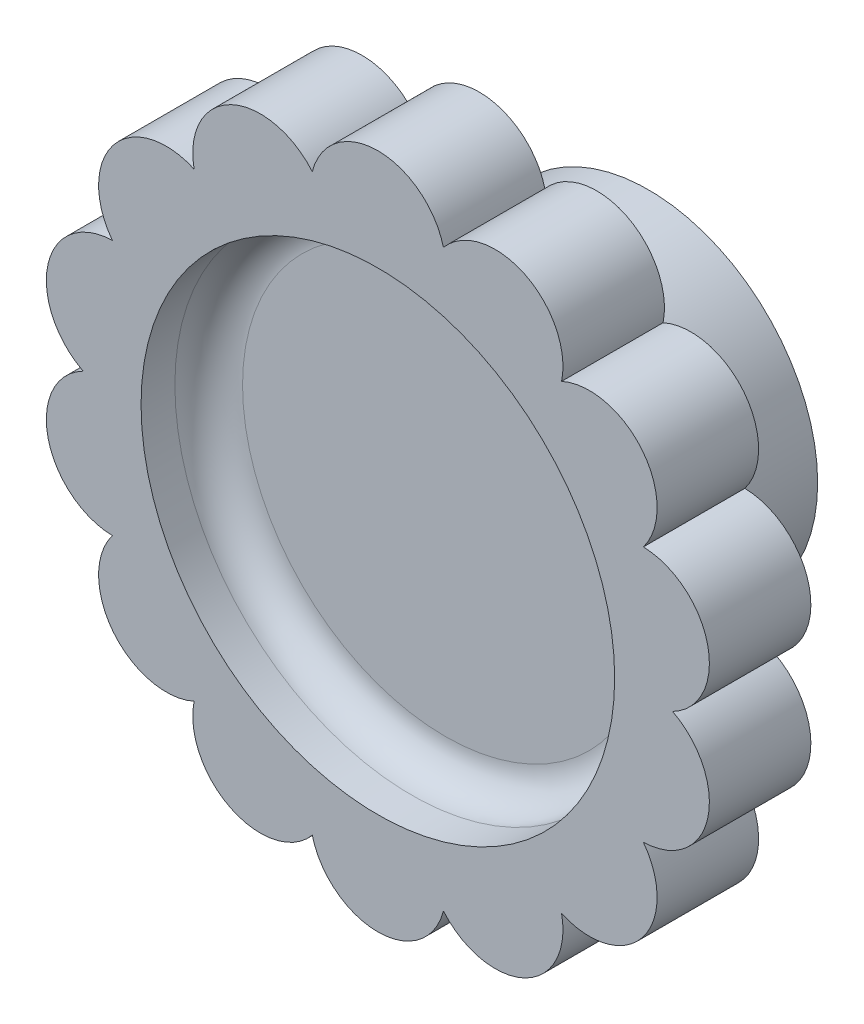
from build123d import *

# Parameters (mm, degrees)
SKETCH_1_R          = 10
SKETCH_1_R_2        = 8
EXTRUDE_1_DEPTH     = 10
EXTRUDE_2_DEPTH     = 6
SKETCH_3_R          = 14
CUT_EXTRUDE_1_DEPTH = 4
FILLET_1_R          = 2


with BuildPart() as part:
    # Эскиз1 → Бобышка-Вытянуть1 (new body)
    with BuildSketch(Plane.XY):
        Circle(SKETCH_1_R)
        Circle(SKETCH_1_R_2, mode=Mode.SUBTRACT)
    extrude(amount=EXTRUDE_1_DEPTH)

    # Эскиз2 → Бобышка-Вытянуть2 (add)
    with BuildSketch(Plane.XY.offset(10)):
        with BuildLine():
            ThreePointArc((3.876767447, 16.985227976), (0, 20), (-3.876767447, 16.985227976))
            ThreePointArc((-3.876767447, 16.985227976), (-8.677674782, 18.019377358), (-10.862461002, 13.621095265))
            ThreePointArc((-10.862461002, 13.621095265), (-15.636629649, 12.469796037), (-15.696710936, 7.559137585))
            ThreePointArc((-15.696710936, 7.559137585), (-19.498558244, 4.450418679), (-17.422034762, 0))
            ThreePointArc((-17.422034762, 0), (-19.498558244, -4.450418679), (-15.696710936, -7.559137585))
            ThreePointArc((-15.696710936, -7.559137585), (-15.636629649, -12.469796037), (-10.862461002, -13.621095265))
            ThreePointArc((-10.862461002, -13.621095265), (-8.677674782, -18.019377358), (-3.876767447, -16.985227976))
            ThreePointArc((-3.876767447, -16.985227976), (0, -20), (3.876767447, -16.985227976))
            ThreePointArc((3.876767447, -16.985227976), (8.677674782, -18.019377358), (10.862461002, -13.621095265))
            ThreePointArc((10.862461002, -13.621095265), (15.636629649, -12.469796037), (15.696710936, -7.559137585))
            ThreePointArc((15.696710936, -7.559137585), (19.498558244, -4.450418679), (17.422034762, 0))
            ThreePointArc((17.422034762, 0), (19.498558244, 4.450418679), (15.696710936, 7.559137585))
            ThreePointArc((15.696710936, 7.559137585), (15.636629649, 12.469796037), (10.862461002, 13.621095265))
            ThreePointArc((10.862461002, 13.621095265), (8.677674782, 18.019377358), (3.876767447, 16.985227976))
        make_face()
    extrude(amount=EXTRUDE_2_DEPTH)

    # Эскиз3 → Вырез-Вытянуть1 (cut)
    with BuildSketch(Plane.XY.offset(16)):
        Circle(SKETCH_3_R)
    extrude(amount=-CUT_EXTRUDE_1_DEPTH, mode=Mode.SUBTRACT)

    # Скругление1
    fillet_1_edges = [part.edges().sort_by_distance(p)[0] for p in [
        (-14, 0, 12),
    ]]
    fillet(fillet_1_edges, radius=FILLET_1_R)


solid = part.part
